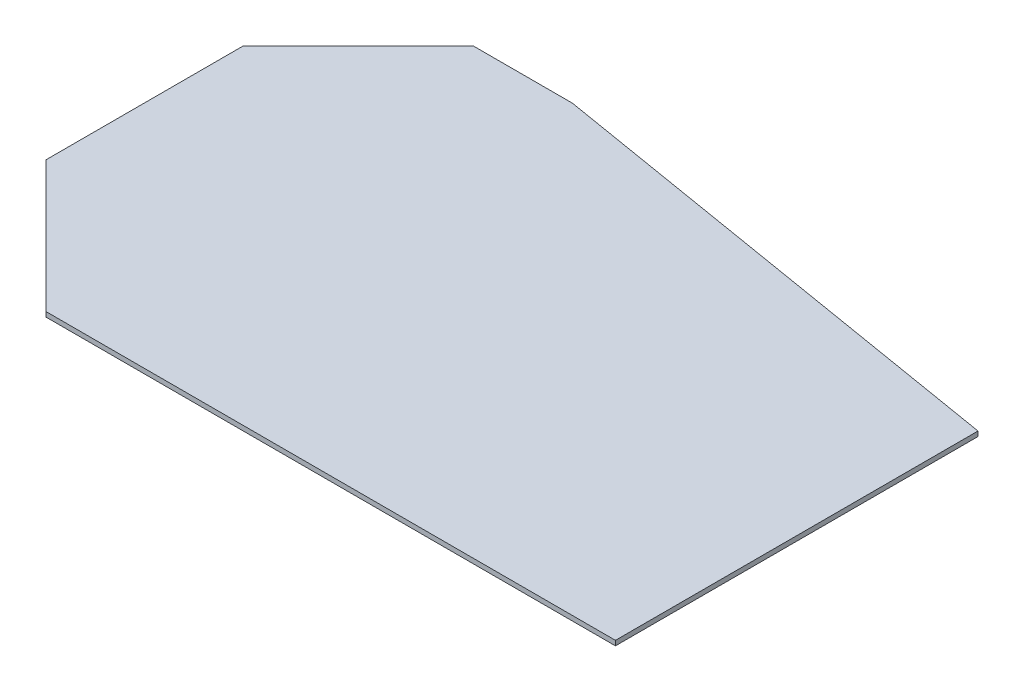
from build123d import *

# Parameters (mm, degrees)
BOSS_EXTRU_1_DEPTH = 3


with BuildPart() as part:
    # Esquisse1 → Boss.-Extru.1 (new body)
    # profile 1 of 2: a face of its own
    with BuildSketch(Plane(origin=(0, 0, 0), x_dir=(1, 0, 0), z_dir=(0, 1, 0))):
        Polygon((103.757359313, 283), (165.248287591, 283), (468, 232.541381265), (468, 7), (113.757359313, 7), (32, 88.757359313), (32, 211.242640687), align=None)
        Polygon((105, 280), (165, 280), (465, 230), (465, 10), (115, 10), (35, 90), (35, 210), align=None, mode=Mode.SUBTRACT)
    # profile 2 of 2: a face of its own
    with BuildSketch(Plane(origin=(0, 0, 0), x_dir=(1, 0, 0), z_dir=(0, 1, 0))):
        Polygon((165, 280), (465, 230), (465, 10), (115, 10), (35, 90), (35, 210), (105, 280), align=None)
    extrude(amount=BOSS_EXTRU_1_DEPTH)


solid = part.part
